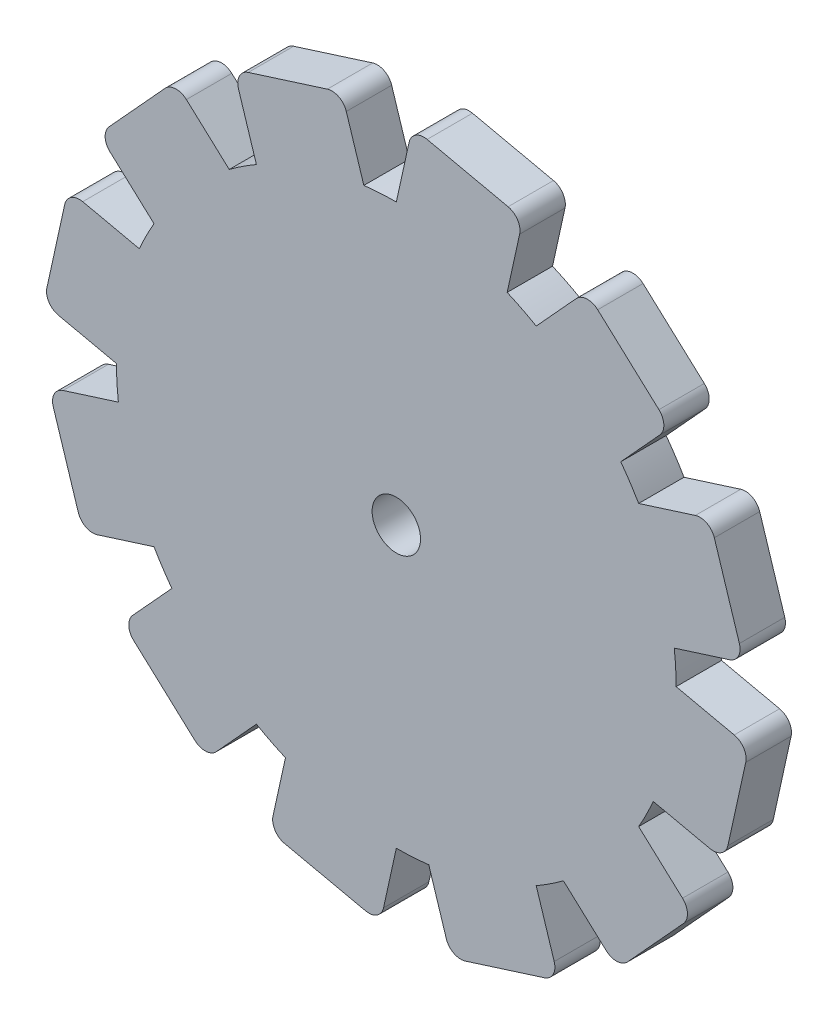
from build123d import *

# Parameters (mm, degrees)
SKETCH1_R           = 18.5
BOSS_EXTRUDE1_DEPTH = 3
BOSS_EXTRUDE2_START = -3
BOSS_EXTRUDE2_DEPTH = 3
SKETCH3_R           = 1.6
CUT_EXTRUDE1_DEPTH  = 3


with BuildPart() as part:
    # Sketch1 → Boss-Extrude1 (new body)
    with BuildSketch(Plane.XY):
        Circle(SKETCH1_R)
    extrude(amount=BOSS_EXTRUDE1_DEPTH)

    # Sketch2 → Boss-Extrude2 (add)
    with BuildSketch(Plane.XY.offset(3).offset(BOSS_EXTRUDE2_START)):
        with BuildLine():
            Line((0.845055361, 22.340372437), (0, 18.5))
            ThreePointArc((0, 18.5), (3.741363138, 18.117731698), (7.32810957, 16.986724526))
            Line((7.32810957, 16.986724526), (8.152336268, 20.732440653))
            ThreePointArc((8.152336268, 20.732440653), (8.018246407, 21.485969914), (7.390604906, 21.923979714))
            Line((7.390604906, 21.923979714), (2.036594422, 23.102103799))
            ThreePointArc((2.036594422, 23.102103799), (1.283065161, 22.968013938), (0.845055361, 22.340372437))
        make_face()
        with BuildLine():
            Line((14.839691312, 11.046880182), (17.426350635, 13.878652154))
            ThreePointArc((17.426350635, 13.878652154), (17.686990039, 14.598272567), (17.362441455, 15.291420931))
            Line((17.362441455, 15.291420931), (13.314794406, 18.98871156))
            ThreePointArc((13.314794406, 18.98871156), (12.595173993, 19.249350964), (11.902025629, 18.92480238))
            Line((11.902025629, 18.92480238), (9.25, 16.02146997))
            ThreePointArc((9.25, 16.02146997), (12.298981371, 13.81973434), (14.839691312, 11.046880182))
        make_face()
        with BuildLine():
            Line((18.374989752, 2.147033214), (22.030988422, 3.306090019))
            ThreePointArc((22.030988422, 3.306090019), (22.616518974, 3.798979875), (22.682025838, 4.561538259))
            Line((22.682025838, 4.561538259), (21.025305982, 9.787309393))
            ThreePointArc((21.025305982, 9.787309393), (20.532416125, 10.372839945), (19.769857741, 10.438346808))
            Line((19.769857741, 10.438346808), (16.02146997, 9.25))
            ThreePointArc((16.02146997, 9.25), (17.561097478, 5.818750327), (18.374989752, 2.147033214))
        make_face()
        with BuildLine():
            Line((16.986724526, -7.32810957), (20.732440653, -8.152336268))
            ThreePointArc((20.732440653, -8.152336268), (21.485969914, -8.018246407), (21.923979714, -7.390604906))
            Line((21.923979714, -7.390604906), (23.102103799, -2.036594422))
            ThreePointArc((23.102103799, -2.036594422), (22.968013938, -1.283065161), (22.340372437, -0.845055361))
            Line((22.340372437, -0.845055361), (18.5, 0))
            ThreePointArc((18.5, 0), (18.117731698, -3.741363138), (16.986724526, -7.32810957))
        make_face()
        with BuildLine():
            Line((11.046880182, -14.839691312), (13.878652154, -17.426350635))
            ThreePointArc((13.878652154, -17.426350635), (14.598272567, -17.686990039), (15.291420931, -17.362441455))
            Line((15.291420931, -17.362441455), (18.98871156, -13.314794406))
            ThreePointArc((18.98871156, -13.314794406), (19.249350964, -12.595173993), (18.92480238, -11.902025629))
            Line((18.92480238, -11.902025629), (16.02146997, -9.25))
            ThreePointArc((16.02146997, -9.25), (13.81973434, -12.298981371), (11.046880182, -14.839691312))
        make_face()
        with BuildLine():
            Line((3.222223056, -21.766447889), (3.306090019, -22.030988422))
            ThreePointArc((3.306090019, -22.030988422), (3.798979875, -22.616518974), (4.561538259, -22.682025838))
            Line((4.561538259, -22.682025838), (9.787309393, -21.025305982))
            ThreePointArc((9.787309393, -21.025305982), (10.372839945, -20.532416125), (10.438346808, -19.769857741))
            Line((10.438346808, -19.769857741), (10.329178092, -19.425508197))
            Line((10.329178092, -19.425508197), (9.25, -16.02146997))
            ThreePointArc((9.25, -16.02146997), (5.818750327, -17.561097478), (2.147033214, -18.374989752))
            Line((2.147033214, -18.374989752), (3.222223056, -21.766447889))
        make_face()
        with BuildLine():
            Line((-7.32810957, -16.986724526), (-8.152336268, -20.732440653))
            ThreePointArc((-8.152336268, -20.732440653), (-8.018246407, -21.485969914), (-7.390604906, -21.923979714))
            Line((-7.390604906, -21.923979714), (-2.036594422, -23.102103799))
            ThreePointArc((-2.036594422, -23.102103799), (-1.283065161, -22.968013938), (-0.845055361, -22.340372437))
            Line((-0.845055361, -22.340372437), (0, -18.5))
            ThreePointArc((0, -18.5), (-3.741363138, -18.117731698), (-7.32810957, -16.986724526))
        make_face()
        with BuildLine():
            Line((-14.839691312, -11.046880182), (-17.426350635, -13.878652154))
            ThreePointArc((-17.426350635, -13.878652154), (-17.686990039, -14.598272567), (-17.362441455, -15.291420931))
            Line((-17.362441455, -15.291420931), (-13.314794406, -18.98871156))
            ThreePointArc((-13.314794406, -18.98871156), (-12.595173993, -19.249350964), (-11.902025629, -18.92480238))
            Line((-11.902025629, -18.92480238), (-9.25, -16.02146997))
            ThreePointArc((-9.25, -16.02146997), (-12.298981371, -13.81973434), (-14.839691312, -11.046880182))
        make_face()
        with BuildLine():
            Line((-18.374989752, -2.147033214), (-22.030988422, -3.306090019))
            ThreePointArc((-22.030988422, -3.306090019), (-22.616518974, -3.798979875), (-22.682025838, -4.561538259))
            Line((-22.682025838, -4.561538259), (-21.025305982, -9.787309393))
            ThreePointArc((-21.025305982, -9.787309393), (-20.532416125, -10.372839945), (-19.769857741, -10.438346808))
            Line((-19.769857741, -10.438346808), (-16.02146997, -9.25))
            ThreePointArc((-16.02146997, -9.25), (-17.561097478, -5.818750327), (-18.374989752, -2.147033214))
        make_face()
        with BuildLine():
            Line((-16.986724526, 7.32810957), (-20.732440653, 8.152336268))
            ThreePointArc((-20.732440653, 8.152336268), (-21.485969914, 8.018246407), (-21.923979714, 7.390604906))
            Line((-21.923979714, 7.390604906), (-23.102103799, 2.036594422))
            ThreePointArc((-23.102103799, 2.036594422), (-22.968013938, 1.283065161), (-22.340372437, 0.845055361))
            Line((-22.340372437, 0.845055361), (-18.5, 0))
            ThreePointArc((-18.5, 0), (-18.117731698, 3.741363138), (-16.986724526, 7.32810957))
        make_face()
        with BuildLine():
            Line((-11.046880182, 14.839691312), (-13.878652154, 17.426350635))
            ThreePointArc((-13.878652154, 17.426350635), (-14.598272567, 17.686990039), (-15.291420931, 17.362441455))
            Line((-15.291420931, 17.362441455), (-18.98871156, 13.314794406))
            ThreePointArc((-18.98871156, 13.314794406), (-19.249350964, 12.595173993), (-18.92480238, 11.902025629))
            Line((-18.92480238, 11.902025629), (-16.02146997, 9.25))
            ThreePointArc((-16.02146997, 9.25), (-13.81973434, 12.298981371), (-11.046880182, 14.839691312))
        make_face()
        with BuildLine():
            Line((-2.147033214, 18.374989752), (-3.306090019, 22.030988422))
            ThreePointArc((-3.306090019, 22.030988422), (-3.798979875, 22.616518974), (-4.561538259, 22.682025838))
            Line((-4.561538259, 22.682025838), (-9.787309393, 21.025305982))
            ThreePointArc((-9.787309393, 21.025305982), (-10.372839945, 20.532416125), (-10.438346808, 19.769857741))
            Line((-10.438346808, 19.769857741), (-9.25, 16.02146997))
            ThreePointArc((-9.25, 16.02146997), (-5.818750327, 17.561097478), (-2.147033214, 18.374989752))
        make_face()
    extrude(amount=BOSS_EXTRUDE2_DEPTH)

    # Sketch3 → Cut-Extrude1 (cut)
    with BuildSketch(Plane.XY.offset(3)):
        Circle(SKETCH3_R)
    extrude(amount=-CUT_EXTRUDE1_DEPTH, mode=Mode.SUBTRACT)


solid = part.part
